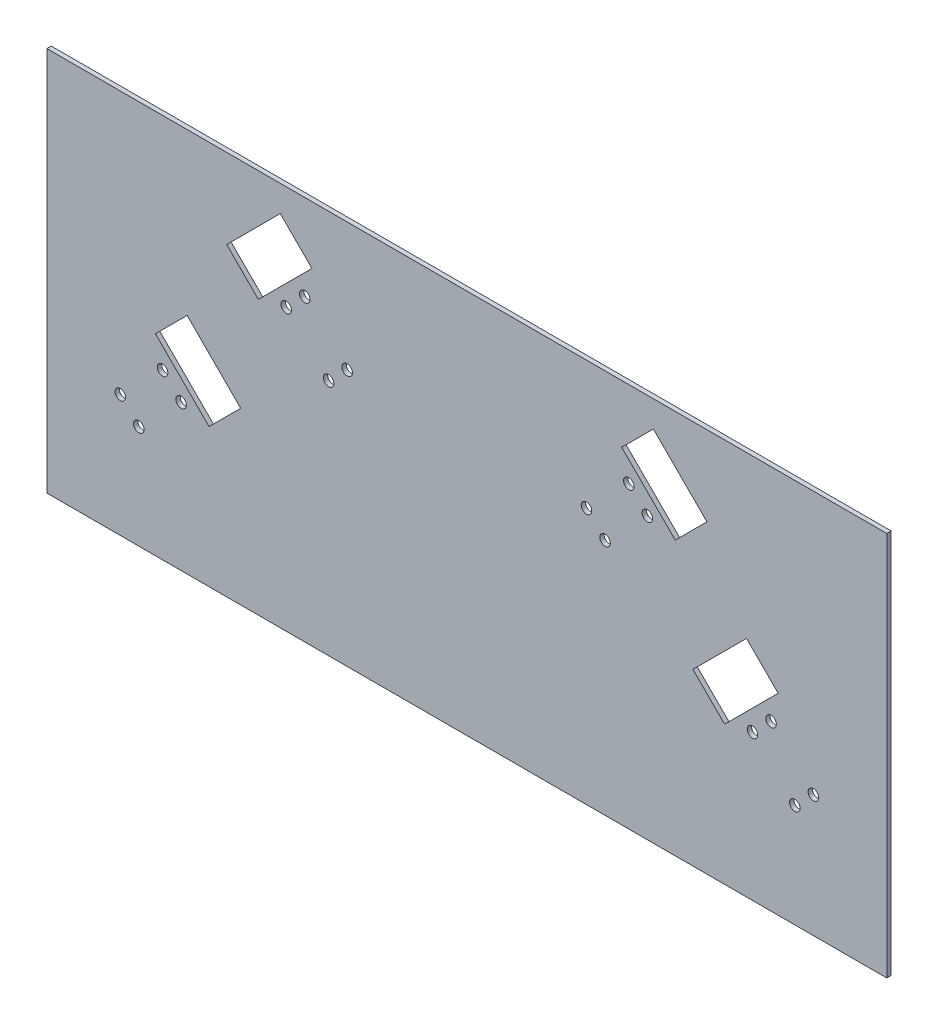
from build123d import *

# Parameters (mm, degrees)
SKETCH1_W           = 609.6
SKETCH1_H           = 279.4
BOSS_EXTRUDE1_DEPTH = 3.175
SKETCH1_9_R         = 3.81
SKETCH1_9_R_2       = 3.822247212
CUT_EXTRUDE1_DEPTH  = 414.49423288
SKETCH1_10_R        = 3.822247212
SKETCH1_10_R_2      = 3.81
CUT_EXTRUDE2_DEPTH  = 414.49423288


with BuildPart() as part:
    # Sketch1 → Boss-Extrude1 (new body)
    with BuildSketch(Plane.XY):
        with Locations((0, -139.7)):
            Rectangle(SKETCH1_W, SKETCH1_H)
    extrude(amount=-BOSS_EXTRUDE1_DEPTH)

    # Sketch1<9> → Cut-Extrude1 (cut, through all)
    with BuildSketch(Plane.XY):
        with Locations((-220.806313845, -160.103502887)):
            Circle(SKETCH1_9_R)
        with Locations((-207.335929664, -173.573887069)):
            Circle(SKETCH1_9_R)
        with Locations((-238.048405598, -204.286363003)):
            Circle(SKETCH1_9_R)
        with Locations((-251.518789779, -190.815978821)):
            Circle(SKETCH1_9_R)
        with Locations((-131.038243043, -75.755014104)):
            Circle(SKETCH1_9_R_2)
        with Locations((-117.567858862, -62.284629922)):
            Circle(SKETCH1_9_R_2)
        with Locations((-86.855382928, -92.997105856)):
            Circle(SKETCH1_9_R_2)
        with Locations((-100.325767109, -106.467490038)):
            Circle(SKETCH1_9_R_2)
        Polygon((-112.401029611, -42.030970389), (-135.382, -19.05), (-174.272872965, -57.940872965), (-151.291902577, -80.921843354), align=None)
        Polygon((-202.992172707, -116.868872965), (-225.973143095, -139.849843354), (-187.08227013, -178.740716319), (-164.101299742, -155.759745931), align=None)
        Polygon((187.08227013, -178.740716319), (225.973143095, -139.849843354), (202.992172707, -116.868872965), (164.101299742, -155.759745931), align=None)
        Polygon((174.272872965, -57.940872965), (135.382, -19.05), (112.401029611, -42.030970389), (151.291902577, -80.921843354), align=None)
    extrude(amount=-CUT_EXTRUDE1_DEPTH, mode=Mode.SUBTRACT)

    # Sketch1<10> → Cut-Extrude2 (cut, through all)
    with BuildSketch(Plane.XY):
        with Locations((100.325767109, -106.467490038)):
            Circle(SKETCH1_10_R)
        with Locations((86.855382928, -92.997105856)):
            Circle(SKETCH1_10_R)
        with Locations((117.567858862, -62.284629922)):
            Circle(SKETCH1_10_R)
        with Locations((131.038243043, -75.755014104)):
            Circle(SKETCH1_10_R)
        with Locations((251.518789779, -190.815978821)):
            Circle(SKETCH1_10_R_2)
        with Locations((238.048405598, -204.286363003)):
            Circle(SKETCH1_10_R_2)
        with Locations((207.335929664, -173.573887069)):
            Circle(SKETCH1_10_R_2)
        with Locations((220.806313845, -160.103502887)):
            Circle(SKETCH1_10_R_2)
    extrude(amount=-CUT_EXTRUDE2_DEPTH, mode=Mode.SUBTRACT)


solid = part.part
